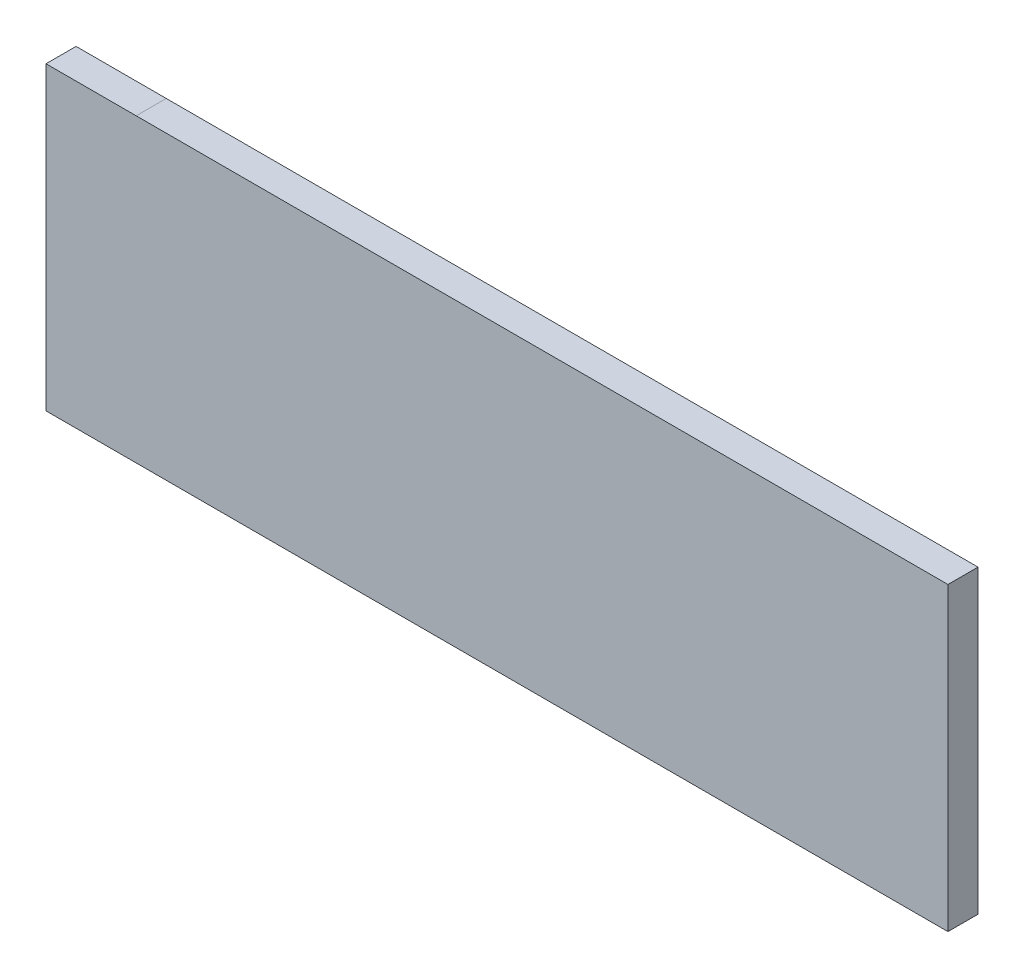
from build123d import *

# Parameters (mm, degrees)
SKETCH1_W           = 3000
SKETCH1_H           = 1000
BOSS_EXTRUDE1_DEPTH = 100


with BuildPart() as part:
    # Sketch1 → Boss-Extrude1 (new body)
    with BuildSketch(Plane.XY):
        with Locations((1500, 500)):
            Rectangle(SKETCH1_W, SKETCH1_H)
    extrude(amount=BOSS_EXTRUDE1_DEPTH)


solid = part.part
